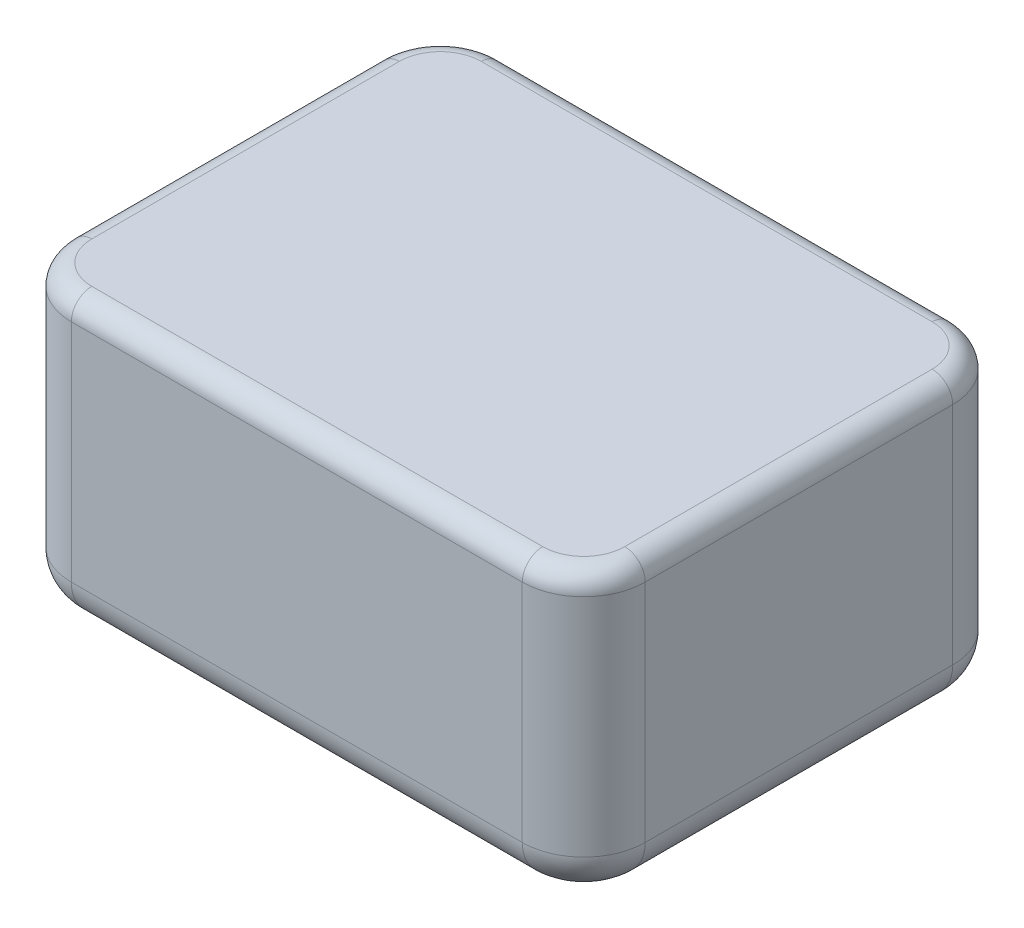
from build123d import *

# Parameters (mm, degrees)
SKETCH_1_W      = 140
SKETCH_1_H      = 105
EXTRUDE_1_DEPTH = 70
FILLET_1_R      = 15
FILLET_2_R      = 10
FILLET_3_R      = 5


with BuildPart() as part:
    # 草图1 → 凸台-拉伸1 (new body)
    with BuildSketch(Plane(origin=(0, 0, 0), x_dir=(1, 0, 0), z_dir=(0, 1, 0))):
        Rectangle(SKETCH_1_W, SKETCH_1_H)
    extrude(amount=EXTRUDE_1_DEPTH)

    # 圆角1
    fillet_1_edges = [part.edges().sort_by_distance(p)[0] for p in [
        (-70, 35, -52.5),
        (70, 35, -52.5),
        (70, 35, 52.5),
        (-70, 35, 52.5),
    ]]
    fillet(fillet_1_edges, radius=FILLET_1_R)

    # 圆角2
    fillet_2_edges = [part.edges().sort_by_distance(p)[0] for p in [
        (-70, 0, 0),
        (0, 0, -52.5),
        (70, 0, 0),
        (0, 0, 52.5),
        (-65.606601718, 0, 48.106601718),
        (65.606601718, 0, 48.106601718),
        (65.606601718, 0, -48.106601718),
        (-65.606601718, 0, -48.106601718),
    ]]
    fillet(fillet_2_edges, radius=FILLET_2_R)

    # 圆角3
    fillet_3_edges = [part.edges().sort_by_distance(p)[0] for p in [
        (-70, 70, 0),
        (0, 70, -52.5),
        (0, 70, 52.5),
        (70, 70, 0),
        (-65.606601718, 70, 48.106601718),
        (65.606601718, 70, 48.106601718),
        (65.606601718, 70, -48.106601718),
        (-65.606601718, 70, -48.106601718),
    ]]
    fillet(fillet_3_edges, radius=FILLET_3_R)


solid = part.part
